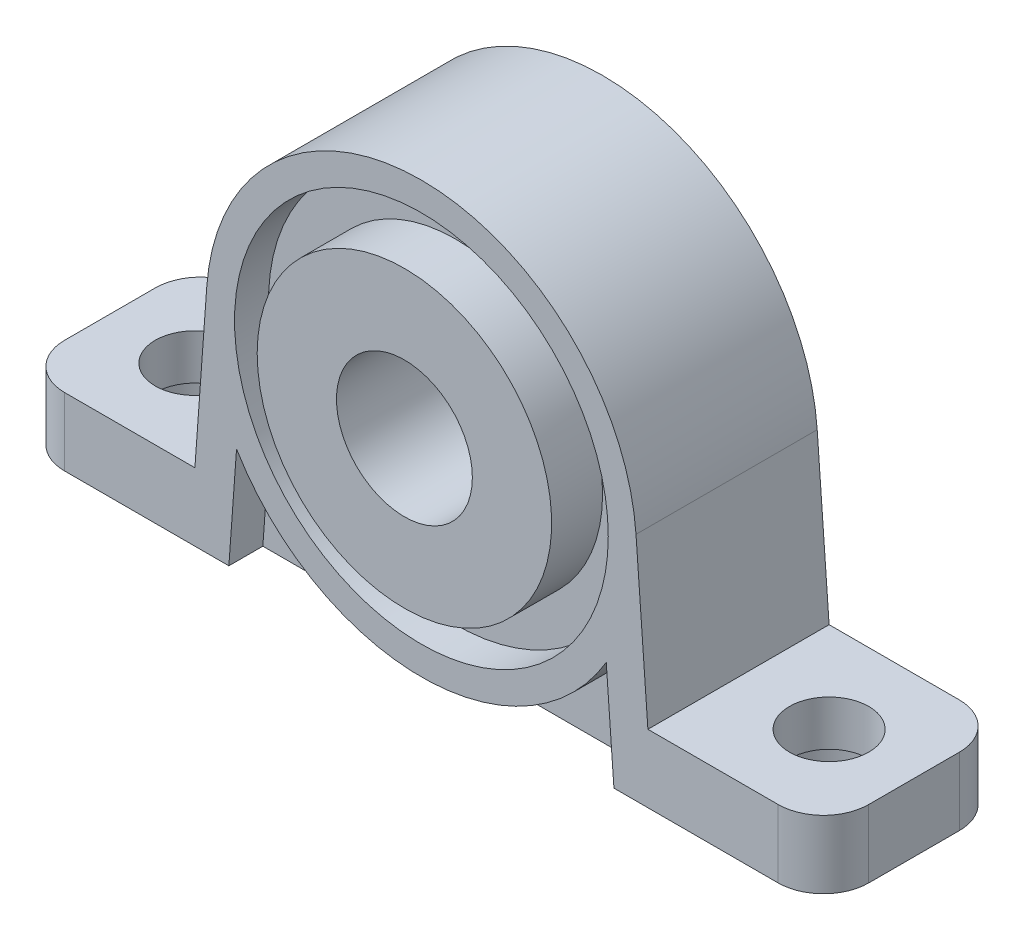
from build123d import *

# Parameters (mm, degrees)
EXTRUDE_1_DEPTH     = 8
EXTRUDE_2_DEPTH     = 5
SKETCH_4_R          = 16.5
CUT_EXTRUDE_1_DEPTH = 3
SKETCH_5_R          = 13
EXTRUDE_3_DEPTH     = 4.5
SKETCH_6_R          = 6
CUT_EXTRUDE_3_DEPTH = 53.834647723
FILLET_1_R          = 4
SKETCH_7_R          = 5
CUT_EXTRUDE_4_DEPTH = 2
CUT_EXTRUDE_5_REACH = 53.444
SKETCH_8_R          = 3.5


with BuildPart() as part:
    # 草图1 → 凸台-拉伸1 (new, symmetric)
    with BuildSketch(Plane.XY):
        with BuildLine():
            ThreePointArc((-16.322626067, 6.275192635), (0, -3), (16.322626067, 6.275192635))
            Line((16.322626067, 6.275192635), (17, -3))
            Line((17, -3), (35.5, -3))
            Line((35.5, -3), (35.5, 3))
            Line((35.5, 3), (20, 3))
            Line((20, 3), (18.949533673, 17.383897959))
            ThreePointArc((18.949533673, 17.383897959), (0, 35), (-18.949533673, 17.383897959))
            Line((-18.949533673, 17.383897959), (-20, 3))
            Line((-20, 3), (-35.5, 3))
            Line((-35.5, 3), (-35.5, -3))
            Line((-35.5, -3), (-17, -3))
            Line((-17, -3), (-16.322626067, 6.275192635))
        make_face()
    extrude(amount=EXTRUDE_1_DEPTH, both=True)

    # 草图3 → 凸台-拉伸2 (add, symmetric)
    with BuildSketch(Plane.XY):
        with BuildLine():
            Line((-16.322626067, 6.275192635), (-17, -3))
            Line((-17, -3), (-6e-08, -3))
            ThreePointArc((-6e-08, -3), (-9.386923379, -0.519251481), (-16.322626067, 6.275192635))
        make_face()
        with BuildLine():
            ThreePointArc((16.322626067, 6.275192635), (9.386923327, -0.51925151), (-6e-08, -3))
            Line((-6e-08, -3), (17, -3))
            Line((17, -3), (16.322626067, 6.275192635))
        make_face()
    extrude(amount=EXTRUDE_2_DEPTH, both=True)

    # 草图4 → 切除-拉伸1 (cut)
    with BuildSketch(Plane.XY.offset(8)):
        with Locations((0, 16)):
            Circle(SKETCH_4_R)
    cut_extrude_1 = extrude(amount=-CUT_EXTRUDE_1_DEPTH, mode=Mode.SUBTRACT)

    # 镜向1: 切除-拉伸1 across plane
    add(cut_extrude_1.mirror(Plane.XY), mode=Mode.SUBTRACT)

    # 草图5 → 凸台-拉伸3 (add)
    with BuildSketch(Plane.XY.offset(5)):
        with Locations(Location((0, 16, 0), (0, 0, 180))):
            Circle(SKETCH_5_R)
    extrude(amount=EXTRUDE_3_DEPTH)

    # 草图6 → 切除-拉伸3 (cut, through all)
    with BuildSketch(Plane.XY.offset(9.5)):
        with Locations((0, 16)):
            Circle(SKETCH_6_R)
    extrude(amount=-CUT_EXTRUDE_3_DEPTH, mode=Mode.SUBTRACT)

    # 圆角1
    fillet_1_edges = [part.edges().sort_by_distance(p)[0] for p in [
        (-35.5, 0, -8),
        (35.5, 0, -8),
        (35.5, 0, 8),
        (-35.5, 0, 8),
    ]]
    fillet(fillet_1_edges, radius=FILLET_1_R)

    # 草图7 → 切除-拉伸4 (cut)
    with BuildSketch(Plane.XZ.offset(3)):
        with Locations(Location((-28, 0, 0), (0, 0, 270))):
            Circle(SKETCH_7_R)
    cut_extrude_4 = extrude(amount=-CUT_EXTRUDE_4_DEPTH, mode=Mode.SUBTRACT)

    # 草图8 → 切除-拉伸5 (cut, up to next)
    with BuildSketch(Plane.XZ.offset(1), mode=Mode.PRIVATE) as cut_extrude_5_sk1:
        with Locations(Location((-28, 0, 0), (0, 0, 270))):
            Circle(SKETCH_8_R)
    cut_extrude_5_tool1 = extrude(cut_extrude_5_sk1.sketch, amount=-CUT_EXTRUDE_5_REACH, mode=Mode.PRIVATE) & part.part
    cut_extrude_5 = cut_extrude_5_tool1.solids().sort_by_distance((-28, -1, 0))[0]
    add(cut_extrude_5, mode=Mode.SUBTRACT)

    # 镜向2: 切除-拉伸4, 切除-拉伸5 across plane
    add(cut_extrude_4.mirror(Plane(origin=(0, 0, 0), x_dir=(0, 0, 1), z_dir=(1, 0, 0))), mode=Mode.SUBTRACT)
    add(cut_extrude_5.mirror(Plane(origin=(0, 0, 0), x_dir=(0, 0, 1), z_dir=(1, 0, 0))), mode=Mode.SUBTRACT)


solid = part.part
